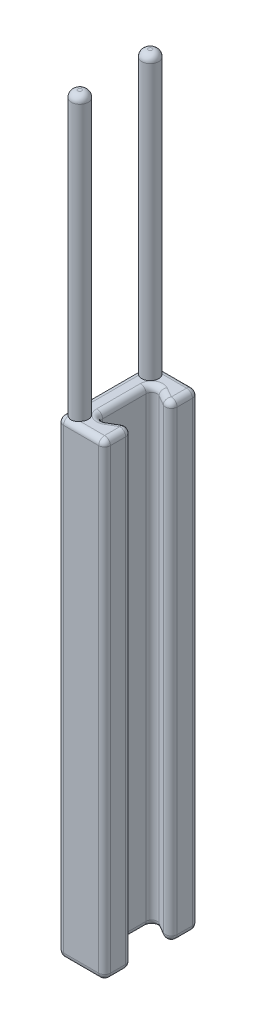
from build123d import *
from OCP.BRepFilletAPI import BRepFilletAPI_MakeFillet

# Parameters (mm, degrees)
BOSS_EXTRUDE2_DEPTH      = 127
FILLET1_R1               = 1.5875
FILLET1_R2               = 1.4732
BOSS_EXTRUDE3_DEPTH      = 76.2
BOSS_EXTRUDE3_DEPTH_BACK = 2.54
SKETCH2_R                = 2.286
FILLET2_R                = 1.778


with BuildPart() as part:
    # Sketch1 → Boss-Extrude2 (new body)
    with BuildSketch(Plane(origin=(0, 0, 0), x_dir=(1, 0, 0), z_dir=(0, 1, 0))):
        Polygon((-28.067579909, 0), (-28.067579909, -25.4), (-15.367579909, -25.4), (-15.367579909, -16.933333333), (-22.699928279, -21.166666582), (-22.699928279, -4.233333249), (-15.367579909, -8.466666667), (-15.367579909, 0), align=None)
    extrude(amount=BOSS_EXTRUDE2_DEPTH)

    # Fillet1: one fillet with a radius per group of edges: ONE call of the kernel's fillet builder (fillet() takes one radius for all edges)
    fillet1_edges_1 = [part.edges().sort_by_distance(p)[0] for p in [
        (-19.033754094, 127, 6.349999958),
        (-22.699928279, 127, 12.699999915),
        (-19.033754094, 127, 19.049999958),
        (-15.367579909, 127, 21.166666667),
        (-15.367579909, 127, 4.233333333),
        (-21.717579909, 127, 0),
        (-28.067579909, 63.5, 0),
        (-15.367579909, 63.5, 0),
        (-21.717579909, 0, 0),
        (-15.367579909, 0, 4.233333333),
        (-15.367579909, 63.5, 8.466666667),
        (-15.367579909, 63.5, 16.933333333),
        (-15.367579909, 0, 21.166666667),
        (-15.367579909, 63.5, 25.4),
        (-22.699928279, 0, 12.699999915),
        (-28.067579909, 127, 12.7),
        (-21.717579909, 127, 25.4),
        (-28.067579909, 63.5, 25.4),
        (-28.067579909, 0, 12.7),
        (-21.717579909, 0, 25.4),
        (-19.033754094, 0, 6.349999958),
        (-19.033754094, 0, 19.049999958),
    ]]
    fillet1_edges_2 = [part.edges().sort_by_distance(p)[0] for p in [
        (-22.699928279, 63.5, 4.233333249),
        (-22.699928279, 63.5, 21.166666582),
    ]]
    fillet1 = BRepFilletAPI_MakeFillet(part.part.solid().wrapped)
    for e in fillet1_edges_1:
        fillet1.Add(FILLET1_R1, e.wrapped)
    for e in fillet1_edges_2:
        fillet1.Add(FILLET1_R2, e.wrapped)
    add(Compound.cast(fillet1.Shape()), mode=Mode.REPLACE)

    # Sketch2 → Boss-Extrude3 (add, two sides: drawn at the far end of the back side and taken through both)
    with BuildSketch(Plane(origin=(0, 127, 0), x_dir=(1, 0, 0), z_dir=(0, 1, 0)).offset(-BOSS_EXTRUDE3_DEPTH_BACK)):
        with Locations((-25.235504788, -3.154170131)):
            Circle(SKETCH2_R)
        with Locations((-25.235504788, -22.245829751)):
            Circle(SKETCH2_R)
    extrude(amount=BOSS_EXTRUDE3_DEPTH + BOSS_EXTRUDE3_DEPTH_BACK)

    # Fillet2
    fillet2_edges = [part.edges().sort_by_distance(p)[0] for p in [
        (-27.521504788, 203.2, 3.154170131),
        (-27.521504788, 203.2, 22.245829751),
    ]]
    fillet(fillet2_edges, radius=FILLET2_R)


solid = part.part
